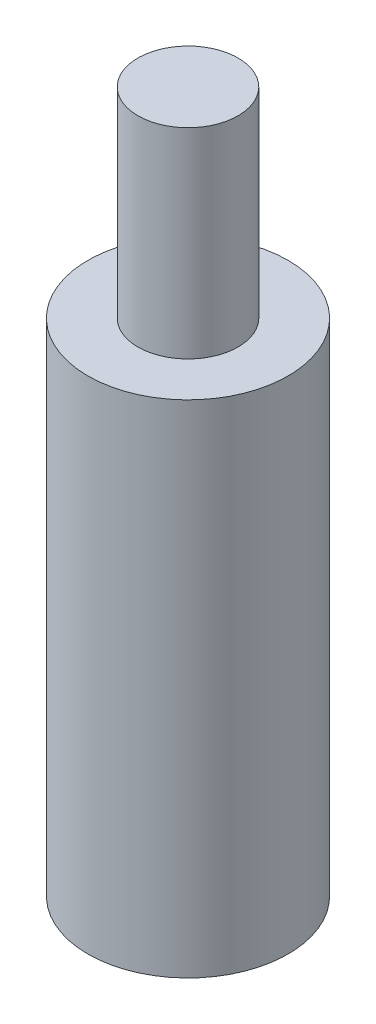
from build123d import *

# Parameters (mm, degrees)
SKETCH1_R           = 2
SKETCH1_R_2         = 1
BOSS_EXTRUDE1_DEPTH = 10
SKETCH2_R           = 1
BOSS_EXTRUDE2_DEPTH = 4


with BuildPart() as part:
    # Sketch1 → Boss-Extrude1 (new body)
    with BuildSketch(Plane(origin=(0, 0, 0), x_dir=(1, 0, 0), z_dir=(0, 1, 0))):
        with Locations(Location((0, 0, 0), (0, 0, 270))):
            Circle(SKETCH1_R)
        with Locations(Location((0, 0, 0), (0, 0, 270))):
            Circle(SKETCH1_R_2, mode=Mode.SUBTRACT)
    extrude(amount=BOSS_EXTRUDE1_DEPTH)


with BuildPart() as body_2:
    # Sketch2 → Boss-Extrude2 (new body)
    with BuildSketch(Plane(origin=(0, 10, 0), x_dir=(1, 0, 0), z_dir=(0, 1, 0))):
        with Locations(Location((0, 0, 0), (0, 0, 270))):
            Circle(SKETCH2_R)
    extrude(amount=BOSS_EXTRUDE2_DEPTH)


solid = Compound([part.part, body_2.part])
